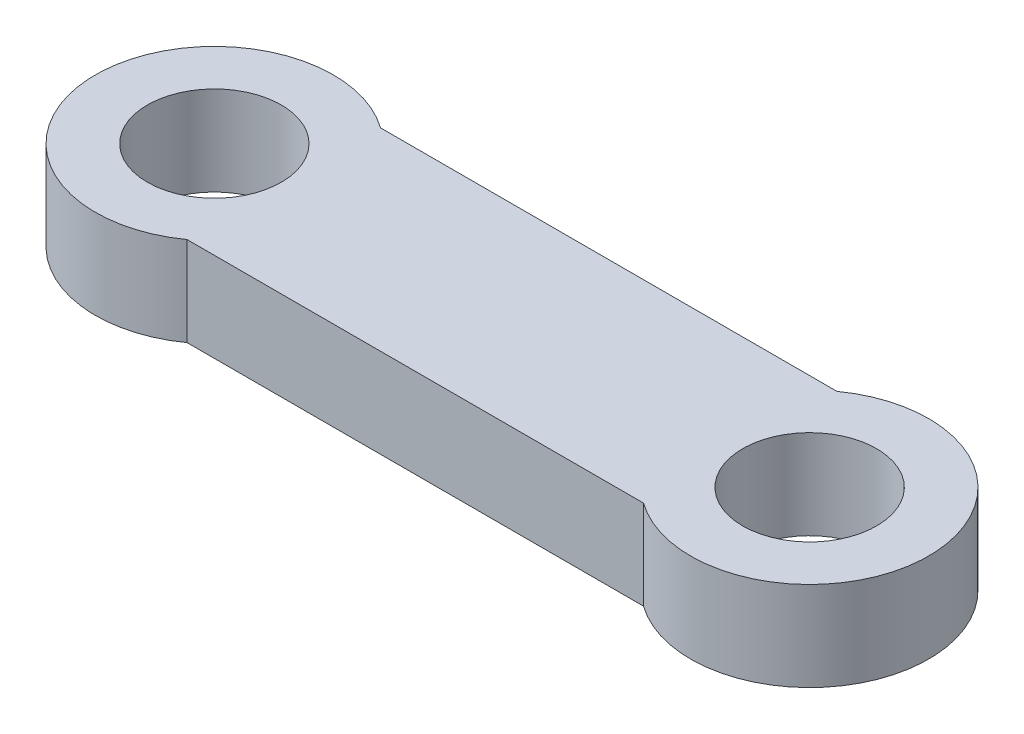
from build123d import *

# Parameters (mm, degrees)
SKETCH_1_R      = 4.5
EXTRUDE_1_DEPTH = 6


with BuildPart() as part:
    # 草图1 → 凸台-拉伸1 (new body)
    with BuildSketch(Plane(origin=(0, 0, 0), x_dir=(1, 0, 0), z_dir=(0, 1, 0))):
        with BuildLine():
            Line((-15.336310473, 6.5), (15.336310473, 6.5))
            ThreePointArc((15.336310473, 6.5), (28, 0), (15.336310473, -6.5))
            Line((15.336310473, -6.5), (-15.336310473, -6.5))
            ThreePointArc((-15.336310473, -6.5), (-28, 0), (-15.336310473, 6.5))
        make_face()
        with Locations(Location((-20, 0, 0), (0, 0, 270))):
            Circle(SKETCH_1_R, mode=Mode.SUBTRACT)
        with Locations(Location((20, 0, 0), (0, 0, 270))):
            Circle(SKETCH_1_R, mode=Mode.SUBTRACT)
    extrude(amount=EXTRUDE_1_DEPTH)


solid = part.part
